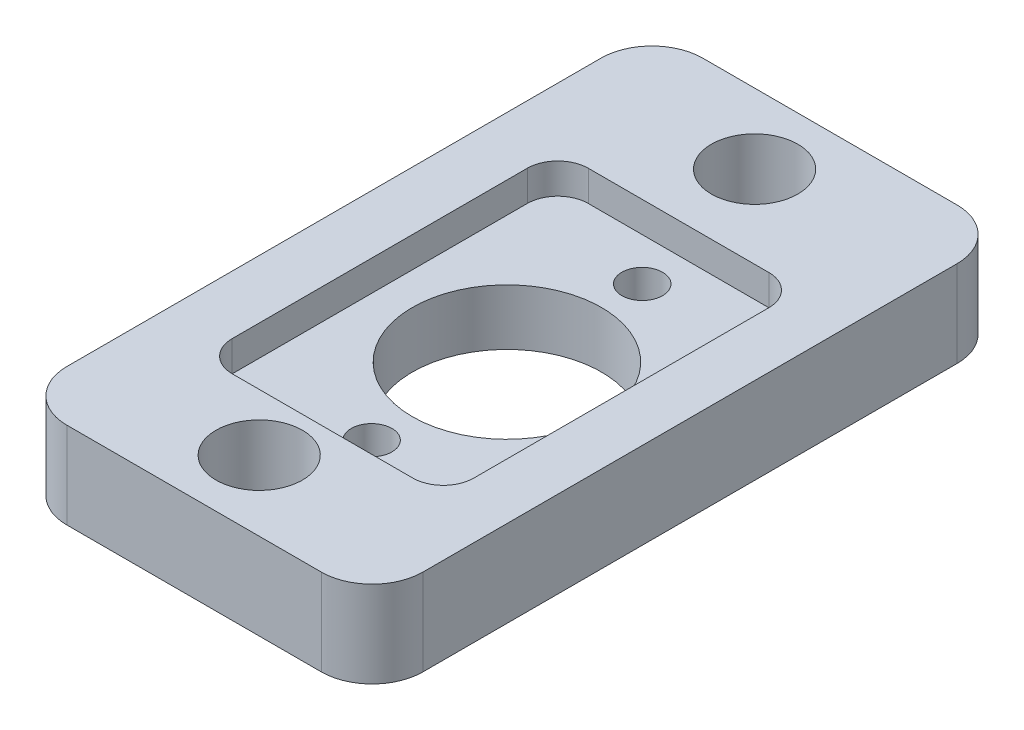
from build123d import *

# Parameters (mm, degrees)
BOSS_EXTRUDE1_DEPTH = 3.4
CUT_EXTRUDE1_DEPTH  = 1.2
SKETCH3_R           = 3.72
SKETCH3_R_2         = 0.8
CUT_EXTRUDE2_DEPTH  = 29.737432036
SKETCH4_R           = 1.7
CUT_EXTRUDE3_DEPTH  = 29.854115824


with BuildPart() as part:
    # Sketch1 → Boss-Extrude1 (new body)
    with BuildSketch(Plane(origin=(0, 0, 0), x_dir=(1, 0, 0), z_dir=(0, 1, 0))):
        with BuildLine():
            Line((2, 0), (12, 0))
            ThreePointArc((12, 0), (13.414213562, -0.585786438), (14, -2))
            Line((14, -2), (14, -23))
            ThreePointArc((14, -23), (13.414213562, -24.414213562), (12, -25))
            Line((12, -25), (2, -25))
            ThreePointArc((2, -25), (0.585786438, -24.414213562), (0, -23))
            Line((0, -23), (0, -2))
            ThreePointArc((0, -2), (0.585786438, -0.585786438), (2, 0))
        make_face()
    extrude(amount=BOSS_EXTRUDE1_DEPTH)

    # Sketch2 → Cut-Extrude1 (cut)
    with BuildSketch(Plane(origin=(0, 3.4, 0), x_dir=(1, 0, 0), z_dir=(0, 1, 0))):
        with BuildLine():
            Line((3.5, -6), (10.6, -6))
            ThreePointArc((10.6, -6), (11.448528137, -6.351471863), (11.8, -7.2))
            Line((11.8, -7.2), (11.8, -18.8))
            ThreePointArc((11.8, -18.8), (11.448528137, -19.648528137), (10.6, -20))
            Line((10.6, -20), (3.5, -20))
            ThreePointArc((3.5, -20), (2.651471863, -19.648528137), (2.3, -18.8))
            Line((2.3, -18.8), (2.3, -7.2))
            ThreePointArc((2.3, -7.2), (2.651471863, -6.351471863), (3.5, -6))
        make_face()
    extrude(amount=-CUT_EXTRUDE1_DEPTH, mode=Mode.SUBTRACT)

    # Sketch3 → Cut-Extrude2 (cut, through all)
    with BuildSketch(Plane(origin=(0, 2.2, 0), x_dir=(1, 0, 0), z_dir=(0, 1, 0))):
        with Locations(Location((7.3, -13, 0), (0, 0, 270))):
            Circle(SKETCH3_R)
        with Locations(Location((7.3, -7.68, 0), (0, 0, 270))):
            Circle(SKETCH3_R_2)
        with Locations(Location((7.3, -18.32, 0), (0, 0, 270))):
            Circle(SKETCH3_R_2)
    extrude(amount=-CUT_EXTRUDE2_DEPTH, mode=Mode.SUBTRACT)

    # Sketch4 → Cut-Extrude3 (cut, through all)
    with BuildSketch(Plane(origin=(0, 3.4, 0), x_dir=(1, 0, 0), z_dir=(0, 1, 0))):
        with Locations(Location((6.8, -2.76, 0), (0, 0, 270))):
            Circle(SKETCH4_R)
        with Locations(Location((6.8, -22.24, 0), (0, 0, 90))):
            Circle(SKETCH4_R)
    extrude(amount=-CUT_EXTRUDE3_DEPTH, mode=Mode.SUBTRACT)


solid = part.part
